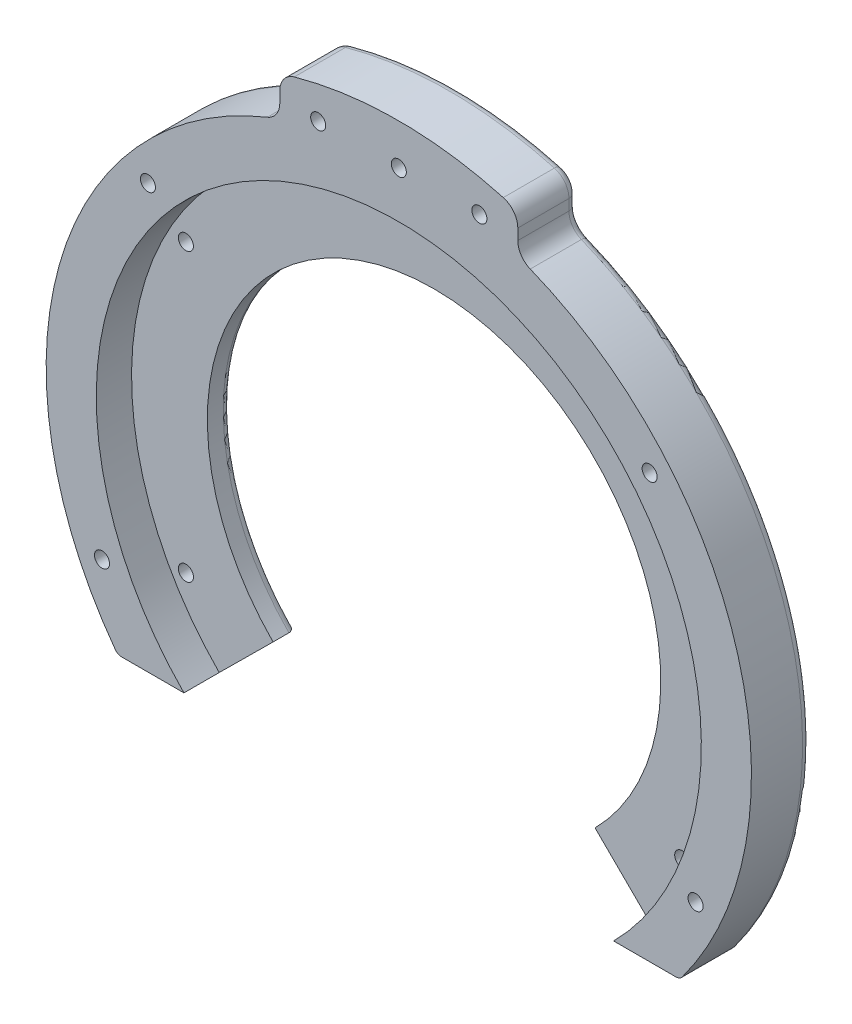
from build123d import *

# Parameters (mm, degrees)
BOSS_EXTRUDE1_DEPTH                            = 6
BOSS_EXTRUDE2_DEPTH                            = 14.89
BOSS_EXTRUDE3_DEPTH                            = 14.89
CBORE_FOR_6_SOCKET_HEAD_CAP_SCREW1_D           = 3.7973
CBORE_FOR_6_SOCKET_HEAD_CAP_SCREW1_CBORE_D     = 7.14502
CBORE_FOR_6_SOCKET_HEAD_CAP_SCREW1_CBORE_DEPTH = 3.5052
F_6_CLEARANCE_HOLE1_D                          = 3.7973
FILLET1_R                                      = 5
FILLET2_R                                      = 5
FILLET3_R                                      = 2
F_6_CLEARANCE_HOLE2_D                          = 3.7973


with BuildPart() as part:
    # Sketch1 → Boss-Extrude1 (new body)
    with BuildSketch(Plane.XY):
        with BuildLine():
            Line((-70.853888546, -53.692983507), (-54.158886199, -53.692983507))
            Line((-54.158886199, -53.692983507), (-40.58534353, -40.236207458))
            ThreePointArc((-40.58534353, -40.236207458), (0, 57.15), (40.58534353, -40.236207458))
            Line((40.58534353, -40.236207458), (54.158886199, -53.692983507))
            Line((54.158886199, -53.692983507), (70.853888546, -53.692983507))
            ThreePointArc((70.853888546, -53.692983507), (0, 88.9), (-70.853888546, -53.692983507))
        make_face()
    extrude(amount=BOSS_EXTRUDE1_DEPTH)

    # Sketch1<3> → Boss-Extrude2 (add)
    with BuildSketch(Plane.XY):
        with BuildLine():
            ThreePointArc((30, 83.685183874), (0, 88.9), (-30, 83.685183874))
            ThreePointArc((-30, 83.685183874), (-85.211894281, 25.340542083), (-70.853888546, -53.692983507))
            Line((-70.853888546, -53.692983507), (-54.158886199, -53.692983507))
            ThreePointArc((-54.158886199, -53.692983507), (-29.032526712, 70.521158704), (76.2635, 0))
            ThreePointArc((76.2635, 0), (70.521158704, -29.032526712), (54.158886199, -53.692983507))
            Line((54.158886199, -53.692983507), (70.853888546, -53.692983507))
            ThreePointArc((70.853888546, -53.692983507), (84.267789492, -28.322246629), (88.9, 0))
            ThreePointArc((88.9, 0), (72.698727637, 51.167421276), (30, 83.685183874))
        make_face()
    extrude(amount=BOSS_EXTRUDE2_DEPTH)

    # Sketch1<4> → Boss-Extrude3 (add)
    with BuildSketch(Plane.XY):
        with BuildLine():
            Line((-30, 93.594750756), (-30, 83.685183874))
            ThreePointArc((-30, 83.685183874), (0, 88.9), (30, 83.685183874))
            Line((30, 83.685183874), (30, 93.594750756))
            ThreePointArc((30, 93.594750756), (0, 98.285183874), (-30, 93.594750756))
        make_face()
    extrude(amount=BOSS_EXTRUDE3_DEPTH)

    # CBORE for #6 Socket Head Cap Screw1 (through all)
    with Locations(Plane(origin=(74.81570782, -34.887137507, 0), x_dir=(-1, 0, 0), z_dir=(0, 0, -1))):
        with Locations((0, 0), (11.578739041, 87.949254687), (138.052676599, 87.949254687), (149.63141564, 0)):
            CounterBoreHole(CBORE_FOR_6_SOCKET_HEAD_CAP_SCREW1_D / 2, CBORE_FOR_6_SOCKET_HEAD_CAP_SCREW1_CBORE_D / 2, CBORE_FOR_6_SOCKET_HEAD_CAP_SCREW1_CBORE_DEPTH)

    # #6 Clearance Hole1 (through all)
    with Locations(Plane(origin=(0, 88, 14.89), x_dir=(1, 0, 0), z_dir=(0, 0, 1))):
        with Locations((0, 0), (20.32, 0), (-20.32, 0)):
            Hole(F_6_CLEARANCE_HOLE1_D / 2)

    # Fillet1
    fillet1_edges = [part.edges().sort_by_distance(p)[0] for p in [
        (30, 83.685183874, 7.445),
        (-30, 83.685183874, 7.445),
    ]]
    fillet(fillet1_edges, radius=FILLET1_R)

    # Fillet2
    fillet2_edges = [part.edges().sort_by_distance(p)[0] for p in [
        (-30, 93.594750756, 7.445),
        (30, 93.594750756, 7.445),
    ]]
    fillet(fillet2_edges, radius=FILLET2_R)

    # Fillet3
    fillet3_edges = [part.edges().sort_by_distance(p)[0] for p in [
        (-85.674892695, 23.728100677, 0),
        (-30.857632087, 84.333147978, 0),
        (-30, 88.503059235, 0),
        (-28.981198623, 92.897735968, 0),
        (0, 98.285183874, 0),
        (28.981198623, 92.897735968, 0),
        (30, 88.503059235, 0),
        (30.857632087, 84.333147978, 0),
        (85.674892695, 23.728100677, 0),
        (0, 57.15, 0),
        (70.853888546, -53.692983507, 7.445),
        (62.506387373, -53.692983507, 0),
        (47.372114864, -46.964595482, 0),
        (-70.853888546, -53.692983507, 7.445),
        (-47.372114864, -46.964595482, 0),
        (-62.506387373, -53.692983507, 0),
    ]]
    fillet(fillet3_edges, radius=FILLET3_R)

    # #6 Clearance Hole2 (through all)
    with Locations(Plane(origin=(62.559596708, -36.1188, 0), x_dir=(-1, 0, 0), z_dir=(0, 0, -1))):
        with Locations((0, 0), (0, 72.2376), (62.559596708, 108.3564), (125.119193416, 72.2376), (125.119193416, 0)):
            Hole(F_6_CLEARANCE_HOLE2_D / 2)


solid = part.part
